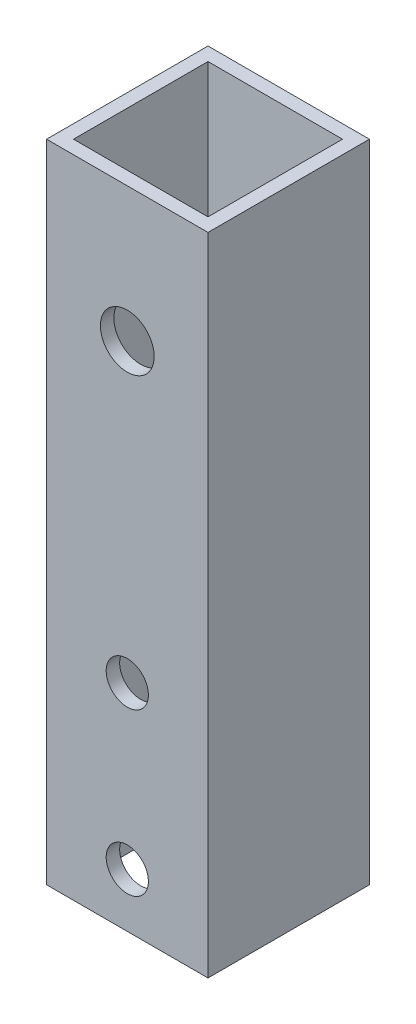
from build123d import *

# Parameters (mm, degrees)
SKETCH1_W           = 19.05
SKETCH1_H           = 19.05
SKETCH1_W_2         = 15.875
SKETCH1_H_2         = 15.875
BOSS_EXTRUDE1_DEPTH = 76.2
SKETCH2_R           = 2.4892
SKETCH2_R_2         = 3.175
CUT_EXTRUDE1_DEPTH  = 80.120592294


with BuildPart() as part:
    # Sketch1 → Boss-Extrude1 (new body)
    with BuildSketch(Plane(origin=(0, 0, 0), x_dir=(1, 0, 0), z_dir=(0, 1, 0))):
        Rectangle(SKETCH1_W, SKETCH1_H)
        Rectangle(SKETCH1_W_2, SKETCH1_H_2, mode=Mode.SUBTRACT)
    extrude(amount=BOSS_EXTRUDE1_DEPTH)

    # Sketch2 → Cut-Extrude1 (cut, through all)
    with BuildSketch(Plane.XY.offset(9.525)):
        with Locations((0, 6.35)):
            Circle(SKETCH2_R)
        with Locations((0, 25.4)):
            Circle(SKETCH2_R)
        with Locations((0, 60.325)):
            Circle(SKETCH2_R_2)
    extrude(amount=-CUT_EXTRUDE1_DEPTH, mode=Mode.SUBTRACT)


solid = part.part
